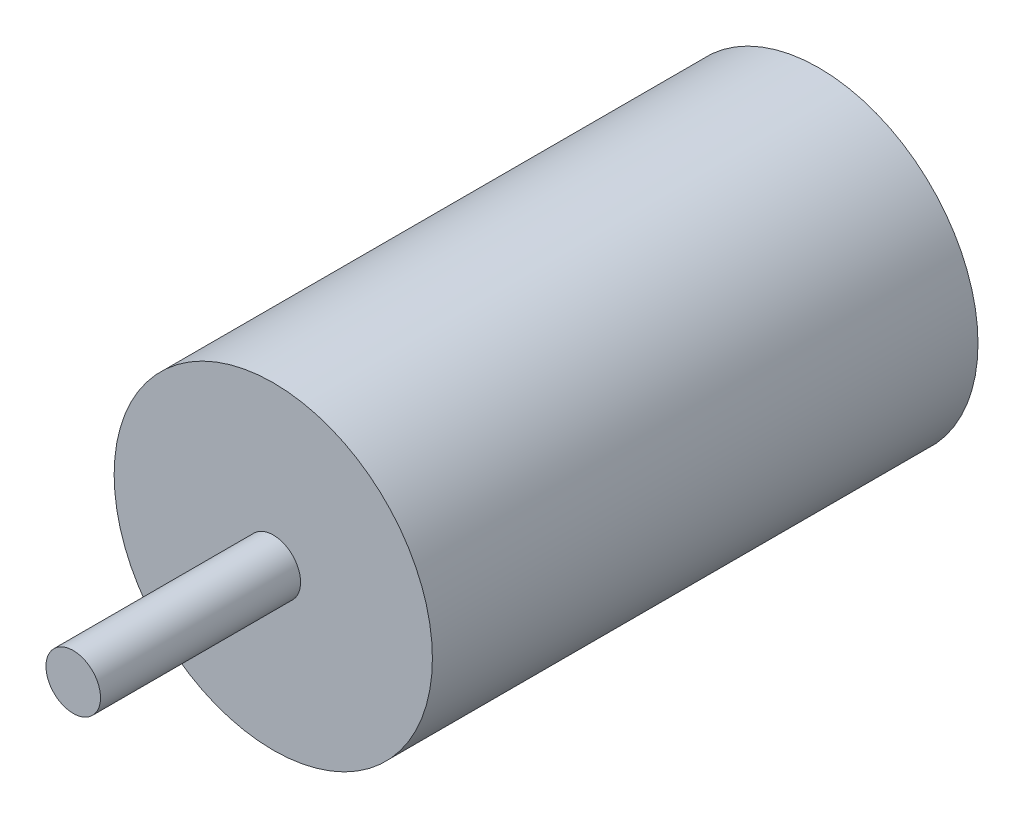
from build123d import *

# Parameters (mm, degrees)
SKETCH1_R           = 17.5
BOSS_EXTRUDE1_DEPTH = 60
SKETCH2_R           = 3
BOSS_EXTRUDE2_DEPTH = 22


with BuildPart() as part:
    # Sketch1 → Boss-Extrude1 (new body)
    with BuildSketch(Plane.XY):
        Circle(SKETCH1_R)
    extrude(amount=BOSS_EXTRUDE1_DEPTH)

    # Sketch2 → Boss-Extrude2 (add)
    with BuildSketch(Plane.XY.offset(60)):
        Circle(SKETCH2_R)
    extrude(amount=BOSS_EXTRUDE2_DEPTH)


solid = part.part
